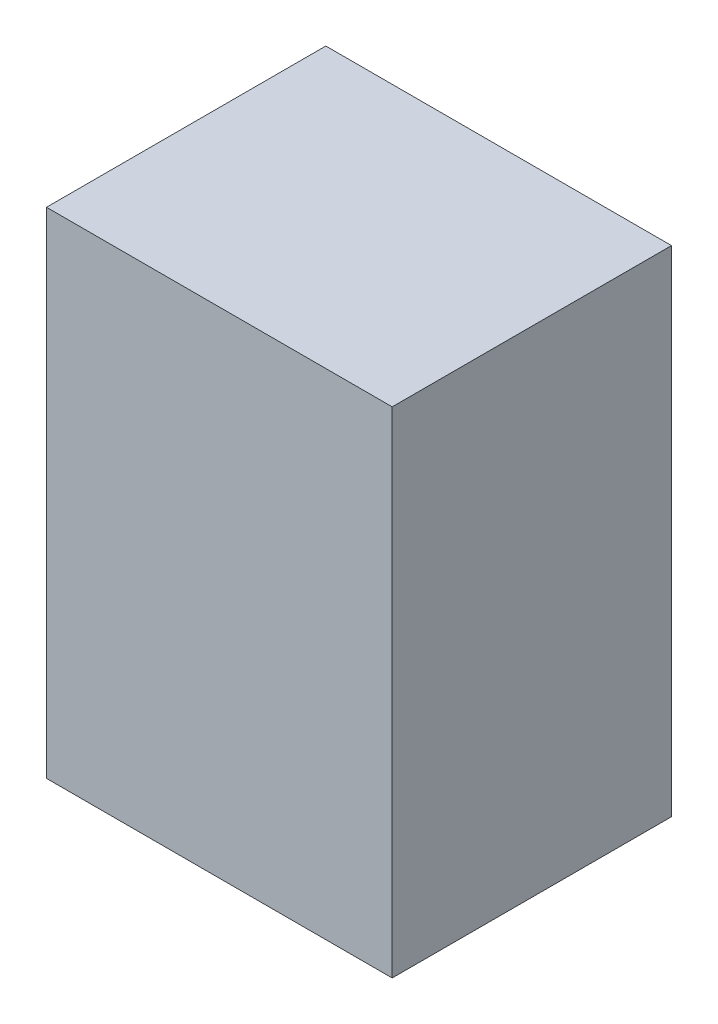
from build123d import *

# Parameters (mm, degrees)
BOSS_EXTRUDE1_DEPTH = 457.2
SKETCH2_W           = 584.708
SKETCH2_H           = 836.676
BOSS_EXTRUDE2_DEPTH = 15.24


with BuildPart() as part:
    # Sketch1 → Boss-Extrude1 (new body)
    with BuildSketch(Plane.XY):
        Polygon((-109.445182115, -28.453743459), (475.262817885, -28.453743459), (475.262817885, -865.129743459), (462.562817885, -865.129743459), (462.562817885, -836.173743459), (462.562817885, -41.153743459), (-96.745182115, -41.153743459), (-96.745182115, -852.429743459), (-96.745182115, -865.129743459), (-109.445182115, -865.129743459), align=None)
    extrude(amount=BOSS_EXTRUDE1_DEPTH)

    # Sketch2 → Boss-Extrude2 (add)
    with BuildSketch(Plane.XY.offset(457.2)):
        with Locations((182.908817885, -446.791743459)):
            Rectangle(SKETCH2_W, SKETCH2_H)
    extrude(amount=BOSS_EXTRUDE2_DEPTH)


solid = part.part
